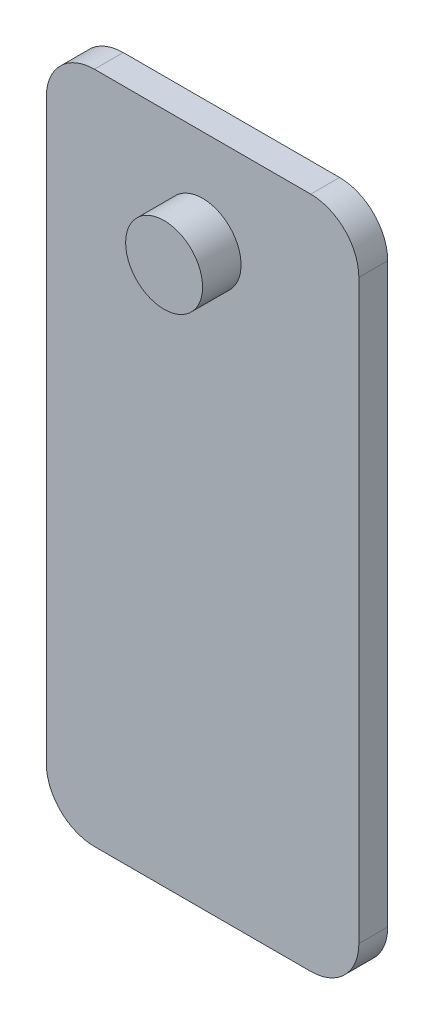
from build123d import *

# Parameters (mm, degrees)
SKETCH1_W           = 32.5
SKETCH1_H           = 70
BOSS_EXTRUDE1_DEPTH = 3
FILLET1_R           = 5
SKETCH2_R           = 4
BOSS_EXTRUDE2_DEPTH = 4
SCALE1_SCALE        = 1.5


with BuildPart() as part:
    # Sketch1 → Boss-Extrude1 (new body)
    with BuildSketch(Plane.XY):
        Rectangle(SKETCH1_W, SKETCH1_H)
    extrude(amount=BOSS_EXTRUDE1_DEPTH)

    # Fillet1
    fillet1_edges = [part.edges().sort_by_distance(p)[0] for p in [
        (-16.25, 35, 1.5),
        (16.25, 35, 1.5),
        (16.25, -35, 1.5),
        (-16.25, -35, 1.5),
    ]]
    fillet(fillet1_edges, radius=FILLET1_R)

    # Sketch2 → Boss-Extrude2 (add)
    with BuildSketch(Plane.XY.offset(3)):
        with Locations(Location((0, 25, 0), (0, 0, 180))):
            Circle(SKETCH2_R)
    extrude(amount=BOSS_EXTRUDE2_DEPTH)


with BuildPart() as part_1:
    # Scale1: scaled about (0, 0.722030781, 1.601084309)
    add(part.part.scale(SCALE1_SCALE).moved(Location((0, -0.36101539, -0.800542154))))


solid = part_1.part
